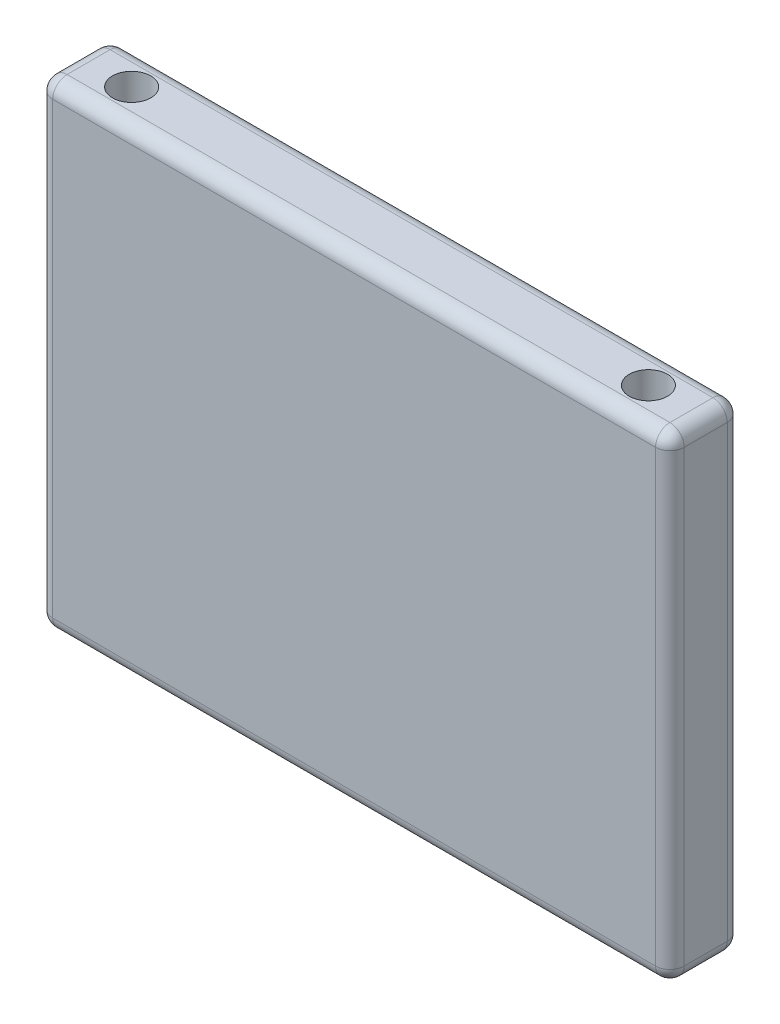
from build123d import *

# Parameters (mm, degrees)
SKETCH1_W           = 132.132132132
SKETCH1_H           = 100
BOSS_EXTRUDE1_DEPTH = 15
SKETCH2_R           = 4
CUT_EXTRUDE1_DEPTH  = 20
FILLET1_R           = 3


with BuildPart() as part:
    # Sketch1 → Boss-Extrude1 (new body)
    with BuildSketch(Plane.XY):
        Rectangle(SKETCH1_W, SKETCH1_H)
    extrude(amount=BOSS_EXTRUDE1_DEPTH)

    # Sketch2 → Cut-Extrude1 (cut)
    with BuildSketch(Plane.XZ.offset(50)):
        with Locations(Location((-54.066066066, 7.5, 0), (0, 0, 270))):
            Circle(SKETCH2_R)
        with Locations(Location((54.066066066, 7.5, 0), (0, 0, 90))):
            Circle(SKETCH2_R)
    cut_extrude1 = extrude(amount=-CUT_EXTRUDE1_DEPTH, mode=Mode.SUBTRACT)

    # Mirror1: Cut-Extrude1 across plane
    add(cut_extrude1.mirror(Plane.ZX), mode=Mode.SUBTRACT)

    # Fillet1
    fillet1_edges = [part.edges().sort_by_distance(p)[0] for p in [
        (-66.066066066, 0, 15),
        (0, -50, 15),
        (66.066066066, 0, 15),
        (0, -50, 0),
        (-66.066066066, 0, 0),
        (0, 50, 0),
        (66.066066066, 0, 0),
        (66.066066066, -50, 7.5),
        (-66.066066066, -50, 7.5),
        (-66.066066066, 50, 7.5),
        (66.066066066, 50, 7.5),
        (0, 50, 15),
    ]]
    fillet(fillet1_edges, radius=FILLET1_R)


solid = part.part
